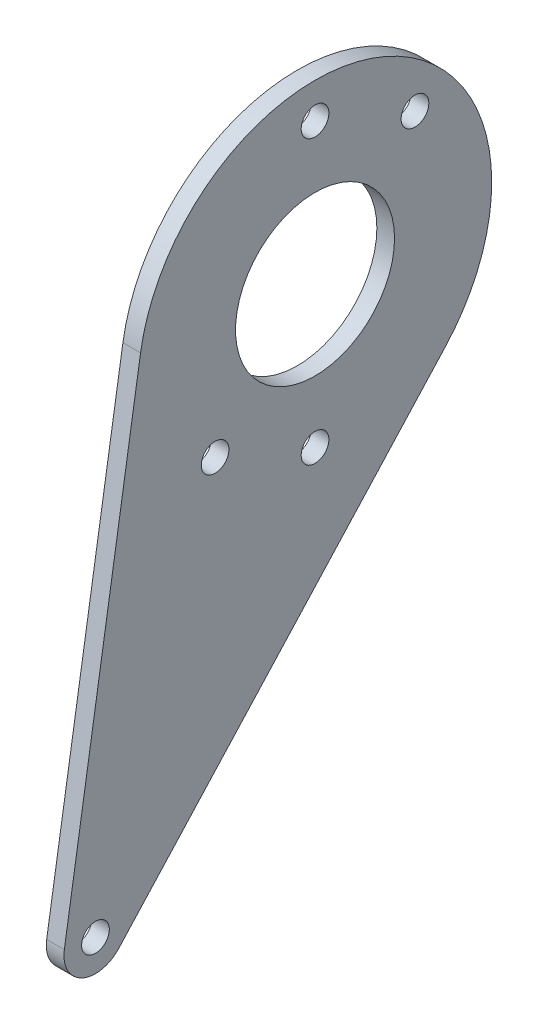
from build123d import *

# Parameters (mm, degrees)
SKETCH2_R                  = 14.2875
SKETCH2_R_2                = 2.4892
BOSS_EXTRUDE1_DEPTH        = 3.175
F_9_0_196_DIAMETER_HOLE1_D = 4.9784


with BuildPart() as part:
    # Sketch2 → Boss-Extrude1 (new body)
    with BuildSketch(Plane.YZ):
        with BuildLine():
            Line((-29.326675554, -4.183509014), (35.011739717, -62.909380508))
            ThreePointArc((35.011739717, -62.909380508), (85.021103942, -53.236877748), (61.408883727, -8.104219103))
            Line((61.408883727, -8.104219103), (-24.617425063, 5.593731781))
            ThreePointArc((-24.617425063, 5.593731781), (-30.611222597, 2.457934521), (-29.326675554, -4.183509014))
        make_face()
        with Locations(Location((56.416233929, -39.459217876, 0), (0, 0, 270))):
            Circle(SKETCH2_R, mode=Mode.SUBTRACT)
        with Locations(Location((-25.508113787, 0, 0), (0, 0, 270))):
            Circle(SKETCH2_R_2, mode=Mode.SUBTRACT)
    extrude(amount=BOSS_EXTRUDE1_DEPTH)

    # #9 (0.196) Diameter Hole1 (through all)
    with Locations(Plane.YZ.offset(3.175)):
        with Locations((81.816233929, -39.459217876), (74.376746171, -57.419730118), (31.016233929, -39.459217876), (38.455721687, -21.498705633)):
            Hole(F_9_0_196_DIAMETER_HOLE1_D / 2)


solid = part.part
